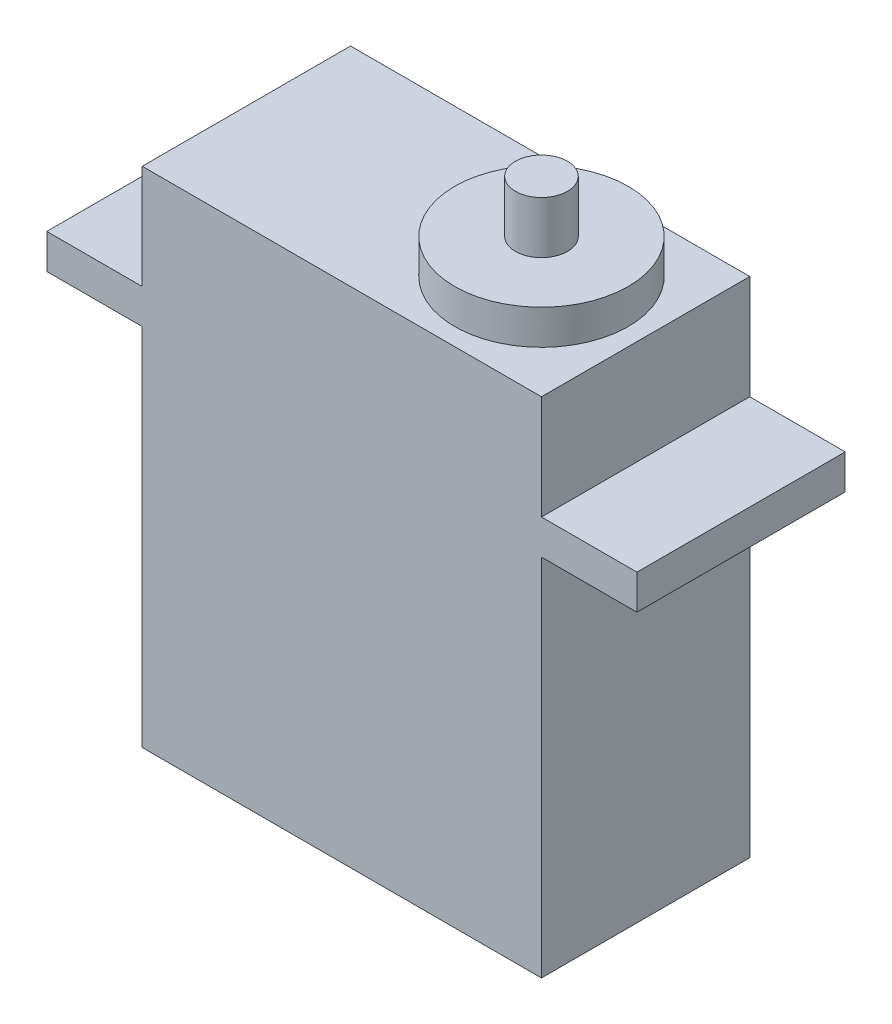
from build123d import *

# Parameters (mm, degrees)
SKETCH1_W           = 23
SKETCH1_H           = 29
BOSS_EXTRUDE1_DEPTH = 12
SKETCH3_W           = 34
SKETCH3_H           = 2
BOSS_EXTRUDE2_DEPTH = 12
SKETCH4_R           = 5
BOSS_EXTRUDE3_DEPTH = 2
SKETCH6_R           = 1.5
BOSS_EXTRUDE4_DEPTH = 3


with BuildPart() as part:
    # Sketch1 → Boss-Extrude1 (new body)
    with BuildSketch(Plane.XY):
        with Locations((11.5, 14.5)):
            Rectangle(SKETCH1_W, SKETCH1_H)
    extrude(amount=BOSS_EXTRUDE1_DEPTH)

    # Sketch3 → Boss-Extrude2 (add)
    with BuildSketch(Plane.XY.offset(12)):
        with Locations((11.5, 22)):
            Rectangle(SKETCH3_W, SKETCH3_H)
    extrude(amount=-BOSS_EXTRUDE2_DEPTH)

    # Sketch4 → Boss-Extrude3 (add)
    with BuildSketch(Plane(origin=(0, 29, 0), x_dir=(1, 0, 0), z_dir=(0, 1, 0))):
        with Locations(Location((17, -6, 0), (0, 0, 90))):
            Circle(SKETCH4_R)
    extrude(amount=BOSS_EXTRUDE3_DEPTH)

    # Sketch6 → Boss-Extrude4 (add)
    with BuildSketch(Plane(origin=(0, 31, 0), x_dir=(1, 0, 0), z_dir=(0, 1, 0))):
        with Locations(Location((17, -6, 0), (0, 0, 270))):
            Circle(SKETCH6_R)
    extrude(amount=BOSS_EXTRUDE4_DEPTH)


solid = part.part
